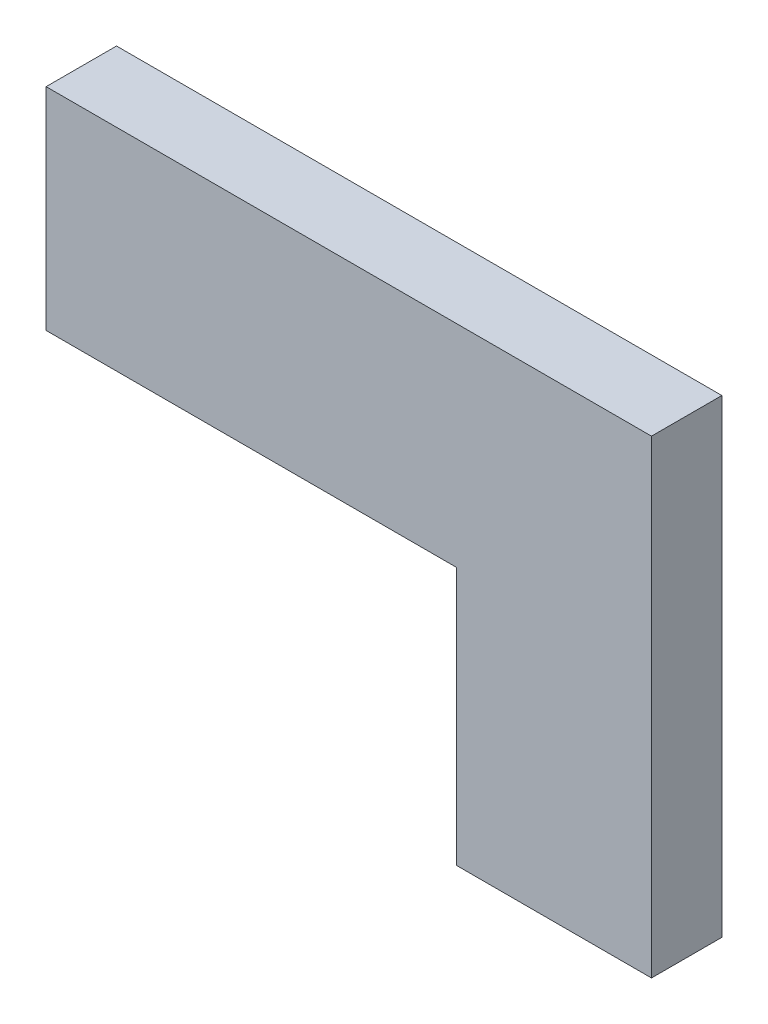
from build123d import *

# Parameters (mm, degrees)
BOSS_EXTRUDE1_DEPTH = 30


with BuildPart() as part:
    # Sketch1 → Boss-Extrude1 (new body)
    with BuildSketch(Plane.XY):
        Polygon((-2.5, 202.5), (255.5, 202.5), (255.5, 2.5), (172.5, 2.5), (172.5, 112.5), (-2.5, 112.5), align=None)
    extrude(amount=BOSS_EXTRUDE1_DEPTH)


solid = part.part
